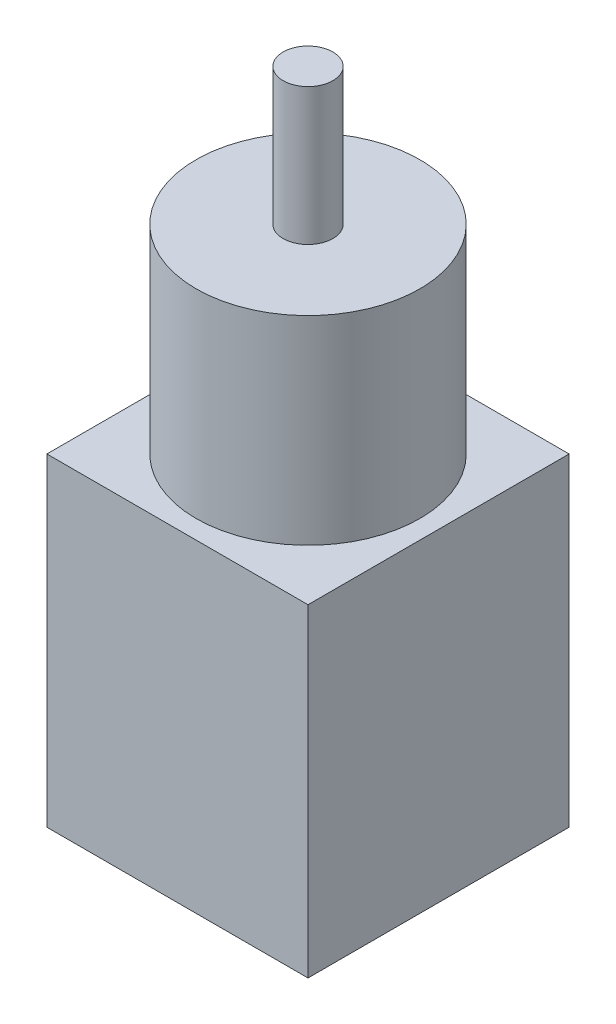
from build123d import *

# Parameters (mm, degrees)
SKETCH1_W           = 42
SKETCH1_H           = 42
BOSS_EXTRUDE1_DEPTH = 52
SKETCH2_R           = 18
BOSS_EXTRUDE2_DEPTH = 32
SKETCH3_R           = 4
BOSS_EXTRUDE3_DEPTH = 22
SKETCH4_R           = 2.5
BOSS_EXTRUDE4_DEPTH = 11


with BuildPart() as part:
    # Sketch1 → Boss-Extrude1 (new body)
    with BuildSketch(Plane(origin=(0, 0, 0), x_dir=(1, 0, 0), z_dir=(0, 1, 0))):
        Rectangle(SKETCH1_W, SKETCH1_H)
    extrude(amount=BOSS_EXTRUDE1_DEPTH)

    # Sketch2 → Boss-Extrude2 (add)
    with BuildSketch(Plane(origin=(0, 52, 0), x_dir=(1, 0, 0), z_dir=(0, 1, 0))):
        with Locations(Location((0, 0, 0), (0, 0, 270))):
            Circle(SKETCH2_R)
    extrude(amount=BOSS_EXTRUDE2_DEPTH)

    # Sketch3 → Boss-Extrude3 (add)
    with BuildSketch(Plane(origin=(0, 84, 0), x_dir=(1, 0, 0), z_dir=(0, 1, 0))):
        with Locations(Location((0, 0, 0), (0, 0, 270))):
            Circle(SKETCH3_R)
    extrude(amount=BOSS_EXTRUDE3_DEPTH)

    # Sketch4 → Boss-Extrude4 (add)
    with BuildSketch(Plane.XZ):
        with Locations(Location((0, 0, 0), (0, 0, 270))):
            Circle(SKETCH4_R)
    extrude(amount=BOSS_EXTRUDE4_DEPTH)


solid = part.part
